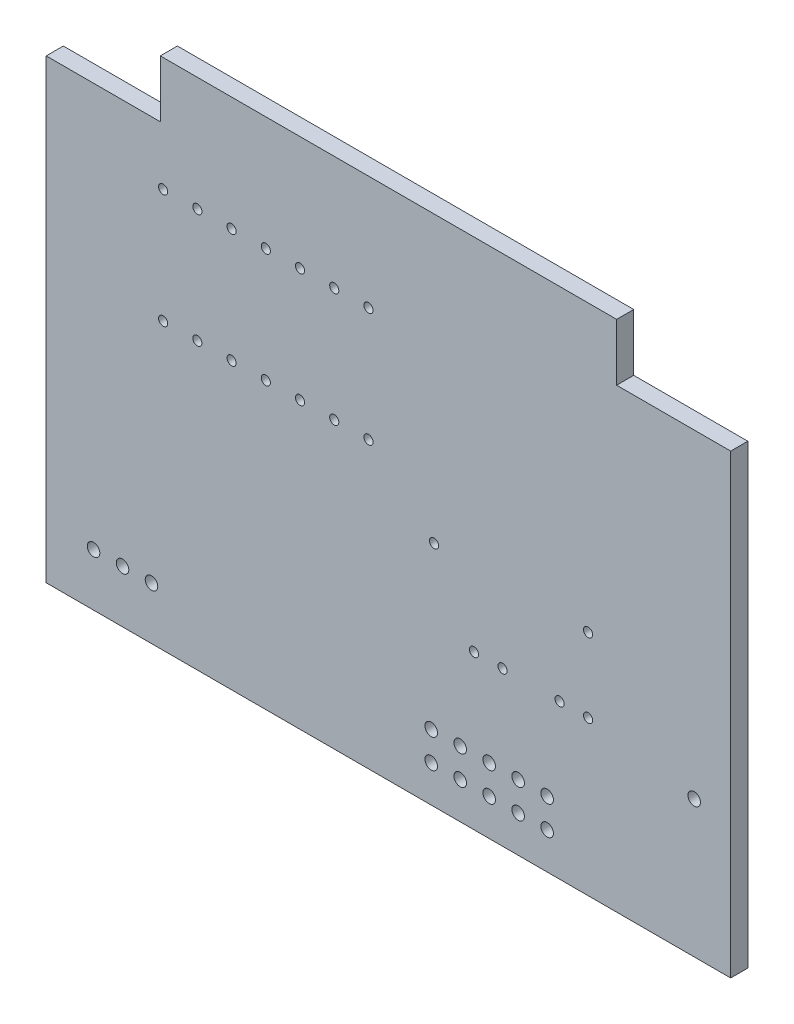
from build123d import *

# Parameters (mm, degrees)
EXTRUDE_1_DEPTH     = 1.5
SKETCH_2_R          = 0.55
CUT_EXTRUDE_1_DEPTH = 1.5
SKETCH_3_R          = 0.4
CUT_EXTRUDE_2_DEPTH = 10
SKETCH_6_R          = 0.4
CUT_EXTRUDE_4_DEPTH = 10
SKETCH_7_W          = 32.724153791
SKETCH_7_H          = 59.56032811
CUT_EXTRUDE_5_DEPTH = 10
SKETCH_8_R          = 0.55
CUT_EXTRUDE_6_DEPTH = 10


with BuildPart() as part:
    # Эскиз1 → Вытянуть1 (new body)
    with BuildSketch(Plane.XY):
        Polygon((0, 20), (0, 25), (40, 25), (40, 20), (50, 20), (50, -20), (-40, -20), (-40, 20), align=None)
    extrude(amount=EXTRUDE_1_DEPTH)

    # Эскиз2 → Вырез-Вытянуть1 (cut)
    with BuildSketch(Plane.XY.offset(1.5)):
        with Locations((-5.85, -15.4)):
            Circle(SKETCH_2_R)
        with Locations((-0.77, -15.4)):
            Circle(SKETCH_2_R)
        with Locations((-3.31, -15.4)):
            Circle(SKETCH_2_R)
        with Locations((23.75, -14.25)):
            Circle(SKETCH_2_R)
        with Locations((23.75, -16.79)):
            Circle(SKETCH_2_R)
        with Locations((26.29, -14.25)):
            Circle(SKETCH_2_R)
        with Locations((26.29, -16.79)):
            Circle(SKETCH_2_R)
        with Locations((28.83, -14.25)):
            Circle(SKETCH_2_R)
        with Locations((28.83, -16.79)):
            Circle(SKETCH_2_R)
        with Locations((31.37, -14.25)):
            Circle(SKETCH_2_R)
        with Locations((31.37, -16.79)):
            Circle(SKETCH_2_R)
        with Locations((33.91, -14.25)):
            Circle(SKETCH_2_R)
        with Locations((33.91, -16.79)):
            Circle(SKETCH_2_R)
    extrude(amount=-CUT_EXTRUDE_1_DEPTH, mode=Mode.SUBTRACT)

    # Эскиз3 → Вырез-Вытянуть2 (cut)
    with BuildSketch(Plane.XY.offset(1.5)):
        with Locations((37.5, -6.5)):
            Circle(SKETCH_3_R)
        with Locations((30, -6.5)):
            Circle(SKETCH_3_R)
        with Locations((0.25, 15)):
            Circle(SKETCH_3_R)
        with Locations((0.25, 5)):
            Circle(SKETCH_3_R)
        with Locations((3.25, 15)):
            Circle(SKETCH_3_R)
        with Locations((3.25, 5)):
            Circle(SKETCH_3_R)
        with Locations((6.25, 15)):
            Circle(SKETCH_3_R)
        with Locations((6.25, 5)):
            Circle(SKETCH_3_R)
        with Locations((9.25, 15)):
            Circle(SKETCH_3_R)
        with Locations((9.25, 5)):
            Circle(SKETCH_3_R)
        with Locations((12.25, 15)):
            Circle(SKETCH_3_R)
        with Locations((12.25, 5)):
            Circle(SKETCH_3_R)
        with Locations((15.25, 15)):
            Circle(SKETCH_3_R)
        with Locations((15.25, 5)):
            Circle(SKETCH_3_R)
        with Locations((18.25, 15)):
            Circle(SKETCH_3_R)
        with Locations((18.25, 5)):
            Circle(SKETCH_3_R)
        with Locations((35, -6.5)):
            Circle(SKETCH_3_R)
        with Locations((27.5, -6.5)):
            Circle(SKETCH_3_R)
    extrude(amount=-CUT_EXTRUDE_2_DEPTH, mode=Mode.SUBTRACT)

    # Эскиз6 → Вырез-Вытянуть4 (cut)
    with BuildSketch(Plane.XY.offset(1.5)):
        with Locations((24, 0)):
            Circle(SKETCH_6_R)
        with Locations((37.5, 0)):
            Circle(SKETCH_6_R)
    extrude(amount=-CUT_EXTRUDE_4_DEPTH, mode=Mode.SUBTRACT)

    # Эскиз7 → Вырез-Вытянуть5 (cut)
    with BuildSketch(Plane(origin=(0, 0, 0), x_dir=(-1, 0, 0), z_dir=(0, 0, -1))):
        with Locations((26.362076896, -0.829414575)):
            Rectangle(SKETCH_7_W, SKETCH_7_H)
    extrude(amount=-CUT_EXTRUDE_5_DEPTH, mode=Mode.SUBTRACT)

    # Эскиз8 → Вырез-Вытянуть6 (cut)
    with BuildSketch(Plane.XY.offset(1.5)):
        with Locations((46.8, -8)):
            Circle(SKETCH_8_R)
    extrude(amount=-CUT_EXTRUDE_6_DEPTH, mode=Mode.SUBTRACT)


solid = part.part
